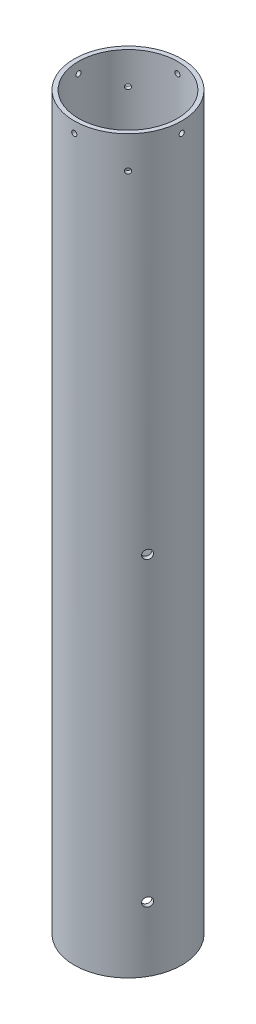
from build123d import *

# Parameters (mm, degrees)
SKETCH_1_R               = 25
SKETCH_1_R_2             = 23
EXTRUDE_1_DEPTH          = 340
SKETCH_2_R               = 1.2
CUT_EXTRUDE_1_DEPTH      = 342.833292703
PATTERN_CIRCULAR_1_COUNT = 4
SKETCH_3_R               = 1.2
CUT_EXTRUDE_2_DEPTH      = 342.833292817
PATTERN_CIRCULAR_2_COUNT = 4
SKETCH_9_R               = 2.05
CUT_EXTRUDE_6_DEPTH      = 95
PATTERN_CIRCULAR_3_COUNT = 3


with BuildPart() as part:
    # Эскиз1 → Бобышка-Вытянуть1 (new body)
    with BuildSketch(Plane(origin=(0, 0, 0), x_dir=(1, 0, 0), z_dir=(0, 1, 0))):
        with Locations(Location((0, 0, 0), (0, 0, 270))):
            Circle(SKETCH_1_R)
        with Locations(Location((0, 0, 0), (0, 0, 270))):
            Circle(SKETCH_1_R_2, mode=Mode.SUBTRACT)
    extrude(amount=EXTRUDE_1_DEPTH)

    # Эскиз2 → Вырез-Вытянуть1 (cut, through all)
    with BuildSketch(Plane(origin=(0, 0, 0), x_dir=(0, 0, -1), z_dir=(1, 0, 0))):
        with Locations((0, 335)):
            Circle(SKETCH_2_R)
    cut_extrude_1 = extrude(amount=-CUT_EXTRUDE_1_DEPTH, mode=Mode.SUBTRACT)

    # Круговой массив1: Вырез-Вытянуть1 ×4 about axis
    pattern_circular_1_axis = Axis((0, 340, 0), (0, -1, 0))
    for i in range(1, PATTERN_CIRCULAR_1_COUNT):
        add(cut_extrude_1.rotate(pattern_circular_1_axis, i * 360 / PATTERN_CIRCULAR_1_COUNT), mode=Mode.SUBTRACT)

    # Эскиз3 → Вырез-Вытянуть2 (cut, through all)
    with BuildSketch(Plane(origin=(0, 0, 0), x_dir=(0, -1, 0), z_dir=(-0.7071067811865488, 0, 0.7071067811865464))):
        with Locations(Location((-325, 0, 0), (0, 0, 90))):
            Circle(SKETCH_3_R)
    cut_extrude_2 = extrude(amount=-CUT_EXTRUDE_2_DEPTH, mode=Mode.SUBTRACT)

    # Круговой массив2: Вырез-Вытянуть2 ×4 about axis
    pattern_circular_2_axis = Axis((0, 340, 0), (0, -1, 0))
    for i in range(1, PATTERN_CIRCULAR_2_COUNT):
        add(cut_extrude_2.rotate(pattern_circular_2_axis, i * 360 / PATTERN_CIRCULAR_2_COUNT), mode=Mode.SUBTRACT)

    # Эскиз9 → Вырез-Вытянуть6 (cut)
    with BuildSketch(Plane.XY):
        with Locations(Location((0, 30, 0), (0, 0, 90))):
            Circle(SKETCH_9_R)
        with Locations(Location((0, 170, 0), (0, 0, 90))):
            Circle(SKETCH_9_R)
    cut_extrude_6 = extrude(amount=-CUT_EXTRUDE_6_DEPTH, mode=Mode.SUBTRACT)

    # Круговой массив3: Вырез-Вытянуть6 ×3 about axis
    pattern_circular_3_axis = Axis((0, 340, 0), (0, -1, 0))
    for i in range(1, PATTERN_CIRCULAR_3_COUNT):
        add(cut_extrude_6.rotate(pattern_circular_3_axis, i * 360 / PATTERN_CIRCULAR_3_COUNT), mode=Mode.SUBTRACT)


solid = part.part
